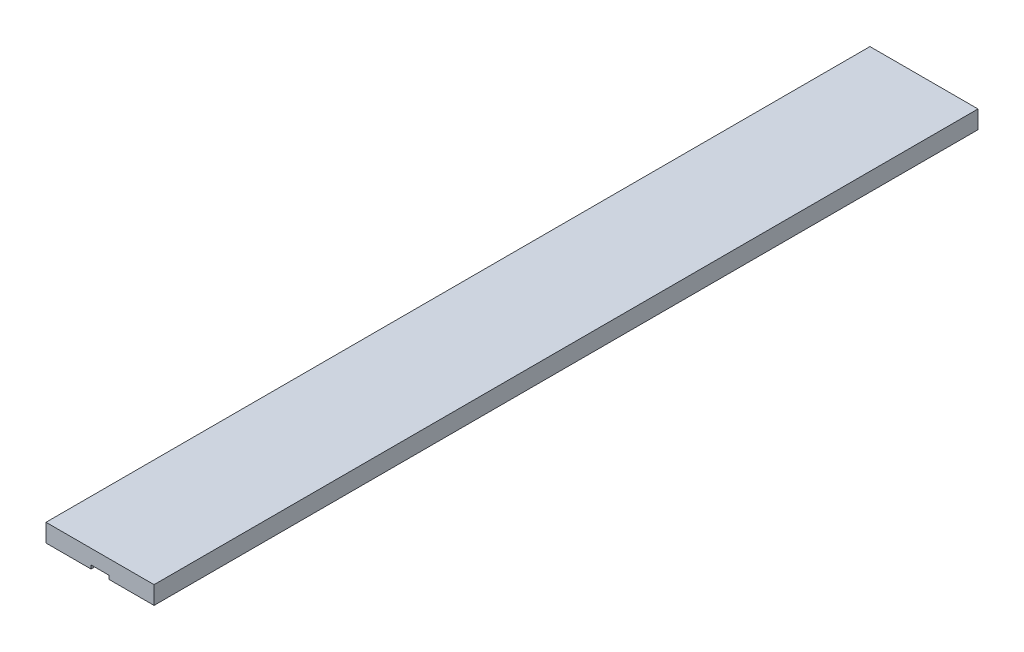
from build123d import *

# Parameters (mm, degrees)
SKETCH_1_W          = 30
SKETCH_1_H          = 228.76
EXTRUDE_1_DEPTH     = 5
SKETCH_2_W          = 5
SKETCH_2_H          = 228.76
CUT_EXTRUDE_1_DEPTH = 1


with BuildPart() as part:
    # 草图1 → 凸台-拉伸1 (new body)
    with BuildSketch(Plane(origin=(0, 0, 0), x_dir=(1, 0, 0), z_dir=(0, 1, 0))):
        with Locations((-66.977829922, -114.38)):
            Rectangle(SKETCH_1_W, SKETCH_1_H)
    extrude(amount=EXTRUDE_1_DEPTH)

    # 草图2 → 切除-拉伸1 (cut)
    with BuildSketch(Plane.XZ):
        with Locations((-66.977829922, 114.38)):
            Rectangle(SKETCH_2_W, SKETCH_2_H)
    extrude(amount=-CUT_EXTRUDE_1_DEPTH, mode=Mode.SUBTRACT)


solid = part.part
